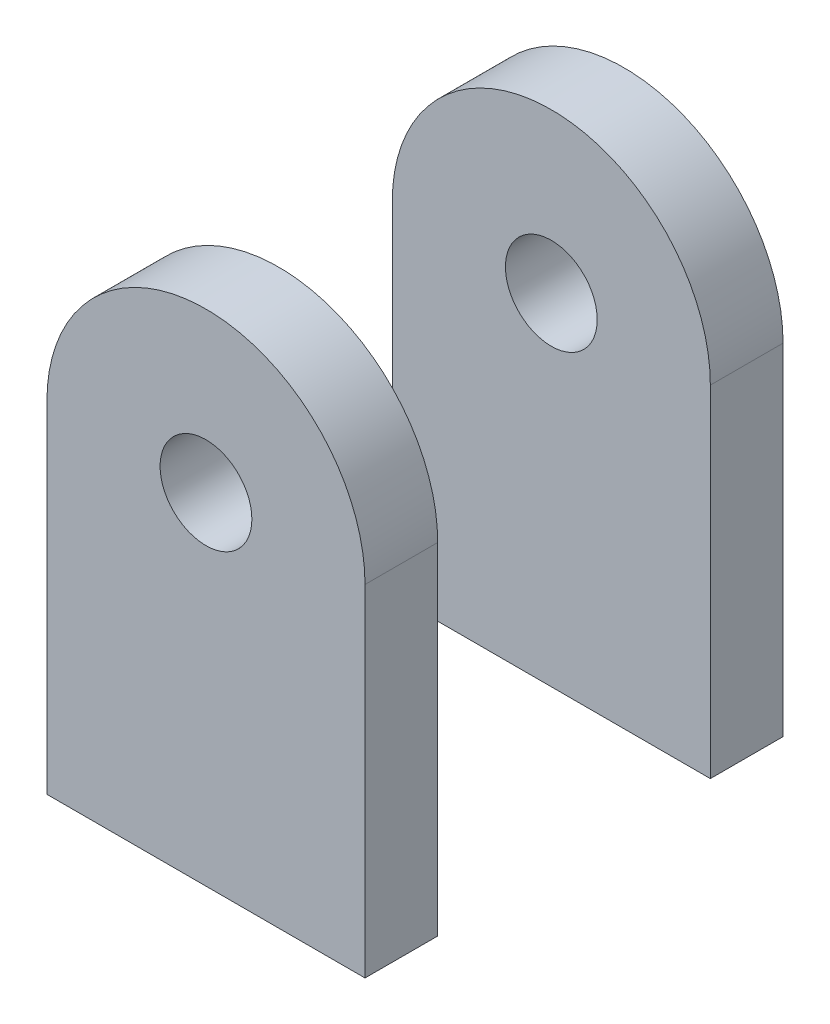
from build123d import *

# Parameters (mm, degrees)
SKETCH1_R           = 5.05
BOSS_EXTRUDE1_DEPTH = 8
SKETCH2_R           = 5.05
BOSS_EXTRUDE2_DEPTH = 8


with BuildPart() as part:
    # Sketch1 → Boss-Extrude1 (new body)
    with BuildSketch(Plane.XY):
        with BuildLine():
            Line((-17.5, 0), (17.5, 0))
            Line((17.5, 0), (17.5, 37.5))
            ThreePointArc((17.5, 37.5), (0, 55), (-17.5, 37.5))
            Line((-17.5, 37.5), (-17.5, 0))
        make_face()
        with Locations((0, 37.5)):
            Circle(SKETCH1_R, mode=Mode.SUBTRACT)
    extrude(amount=BOSS_EXTRUDE1_DEPTH)


with BuildPart() as body_2:
    # Sketch2 → Boss-Extrude2 (new body)
    with BuildSketch(Plane.XY.offset(-30)):
        with BuildLine():
            Line((17.5, 0), (17.5, 37.5))
            ThreePointArc((17.5, 37.5), (0, 55), (-17.5, 37.5))
            Line((-17.5, 37.5), (-17.5, 0))
            Line((-17.5, 0), (17.5, 0))
        make_face()
        with Locations((0, 37.5)):
            Circle(SKETCH2_R, mode=Mode.SUBTRACT)
    extrude(amount=-BOSS_EXTRUDE2_DEPTH)


solid = Compound([part.part, body_2.part])
